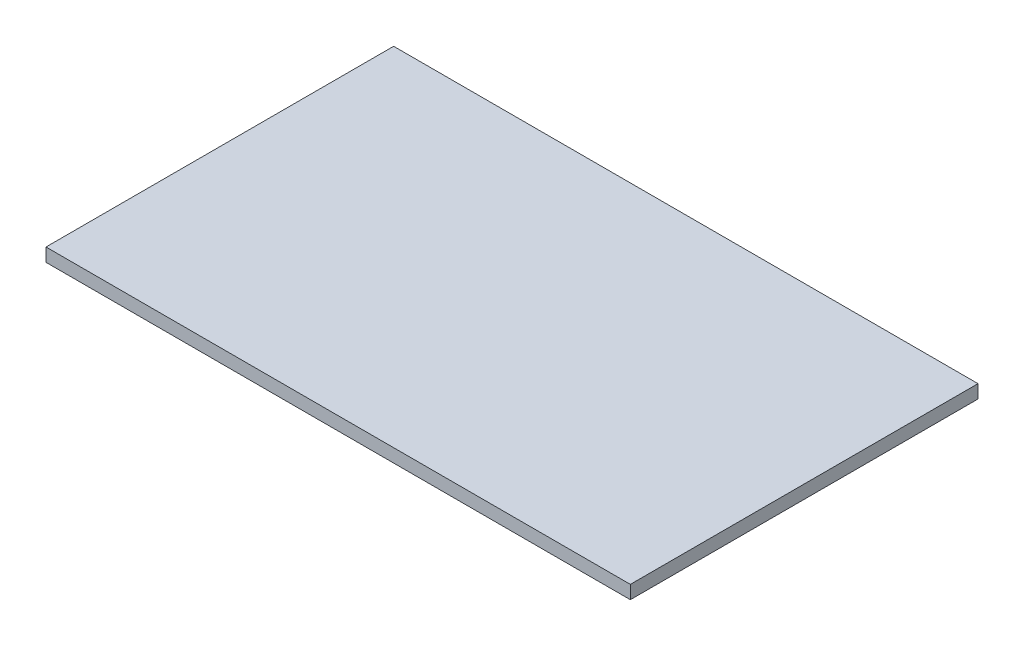
from build123d import *

# Parameters (mm, degrees)
SKETCH1_W           = 790
SKETCH1_H           = 470
BOSS_EXTRUDE1_DEPTH = 18


with BuildPart() as part:
    # Sketch1 → Boss-Extrude1 (new body)
    with BuildSketch(Plane(origin=(0, 0, 0), x_dir=(1, 0, 0), z_dir=(0, 1, 0))):
        Rectangle(SKETCH1_W, SKETCH1_H)
    extrude(amount=BOSS_EXTRUDE1_DEPTH)


solid = part.part
